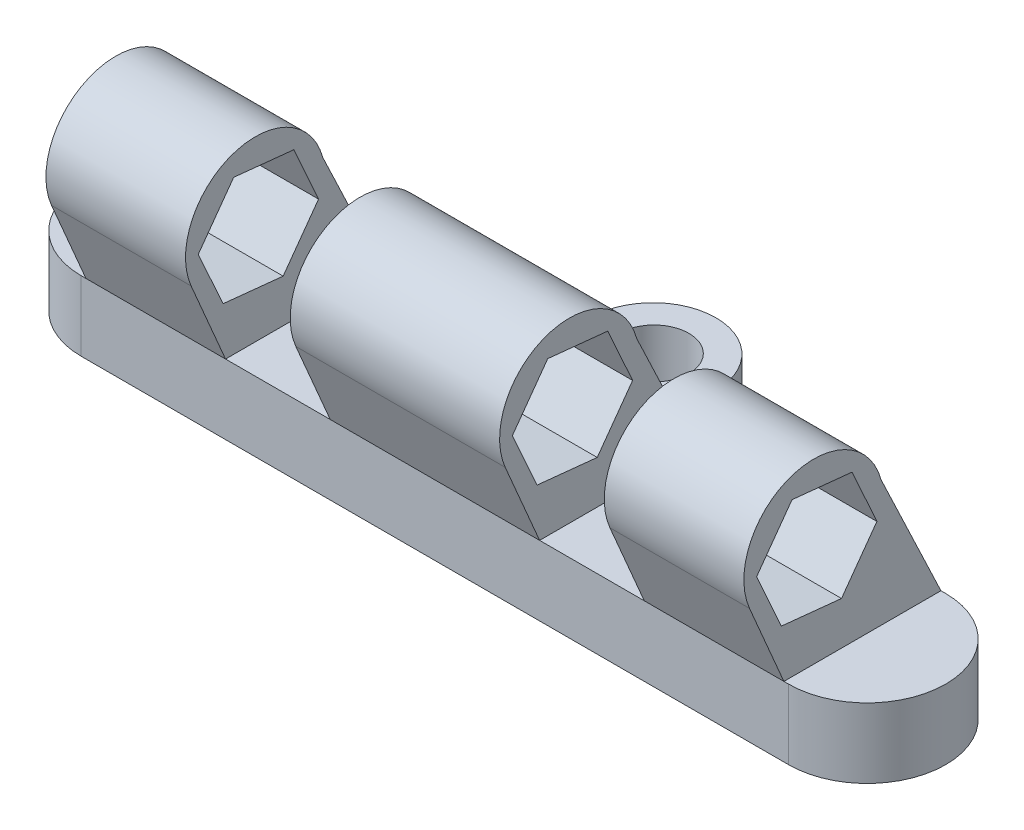
from build123d import *

# Parameters (mm, degrees)
EXTRUDE_1_DEPTH     = 2
SKETCH_3_R          = 1
CUT_EXTRUDE_1_DEPTH = 2
EXTRUDE_2_DEPTH     = 10
CUT_EXTRUDE_2_DEPTH = 20
SKETCH_9_W          = 3
SKETCH_9_H          = 8.464174718
CUT_EXTRUDE_3_DEPTH = 10


with BuildPart() as part:
    # 草图2 → 凸台-拉伸1 (new body)
    with BuildSketch(Plane(origin=(0, 0, 0), x_dir=(1, 0, 0), z_dir=(0, 1, 0))):
        with BuildLine():
            Line((-10.13605196, 2.25), (-1.801845215, 2.25))
            Line((-1.801845215, 2.25), (-1.801845215, 4))
            ThreePointArc((-1.801845215, 4), (0, 5.801845215), (1.801845215, 4))
            Line((1.801845215, 4), (1.801845215, 2.25))
            Line((1.801845215, 2.25), (10.13605196, 2.25))
            ThreePointArc((10.13605196, 2.25), (12.38605196, 0), (10.13605196, -2.25))
            Line((10.13605196, -2.25), (-10.13605196, -2.25))
            ThreePointArc((-10.13605196, -2.25), (-12.38605196, 0), (-10.13605196, 2.25))
        make_face()
    extrude(amount=EXTRUDE_1_DEPTH)

    # 草图3 → 切除-拉伸1 (cut)
    with BuildSketch(Plane(origin=(0, 2, 0), x_dir=(1, 0, 0), z_dir=(0, 1, 0))):
        with Locations(Location((0, 4.027870037, 0), (0, 0, 270))):
            Circle(SKETCH_3_R)
    extrude(amount=-CUT_EXTRUDE_1_DEPTH, mode=Mode.SUBTRACT)

    # 草图4 → 凸台-拉伸2 (add, symmetric)
    with BuildSketch(Plane(origin=(0, 0, 0), x_dir=(0, 0, -1), z_dir=(1, 0, 0))):
        with BuildLine():
            Line((2.25, 2), (0.533443954, 5.615166387))
            ThreePointArc((0.533443954, 5.615166387), (-2.053385242, 6.980617435), (-3.235702378, 4.305123453))
            Line((-3.235702378, 4.305123453), (-2.25, 2))
            Line((-2.25, 2), (2.25, 2))
        make_face()
    extrude(amount=EXTRUDE_2_DEPTH, both=True)

    # 草图8 → 切除-拉伸2 (cut)
    with BuildSketch(Plane.ZY.offset(10)):
        Polygon((0.599367488, 3.232629101), (2.322446911, 3.408689608), (3.031513751, 4.988950414), (2.017501168, 6.393150714), (0.294421745, 6.217090207), (-0.414645095, 4.6368294), align=None)
    extrude(amount=-CUT_EXTRUDE_2_DEPTH, mode=Mode.SUBTRACT)

    # 草图9 → 切除-拉伸3 (cut, symmetric)
    with BuildSketch(Plane.XY):
        with Locations((-4.5, 6.232087359)):
            Rectangle(SKETCH_9_W, SKETCH_9_H)
        with Locations((4.5, 6.232087359)):
            Rectangle(SKETCH_9_W, SKETCH_9_H)
    extrude(amount=CUT_EXTRUDE_3_DEPTH, both=True, mode=Mode.SUBTRACT)


solid = part.part
